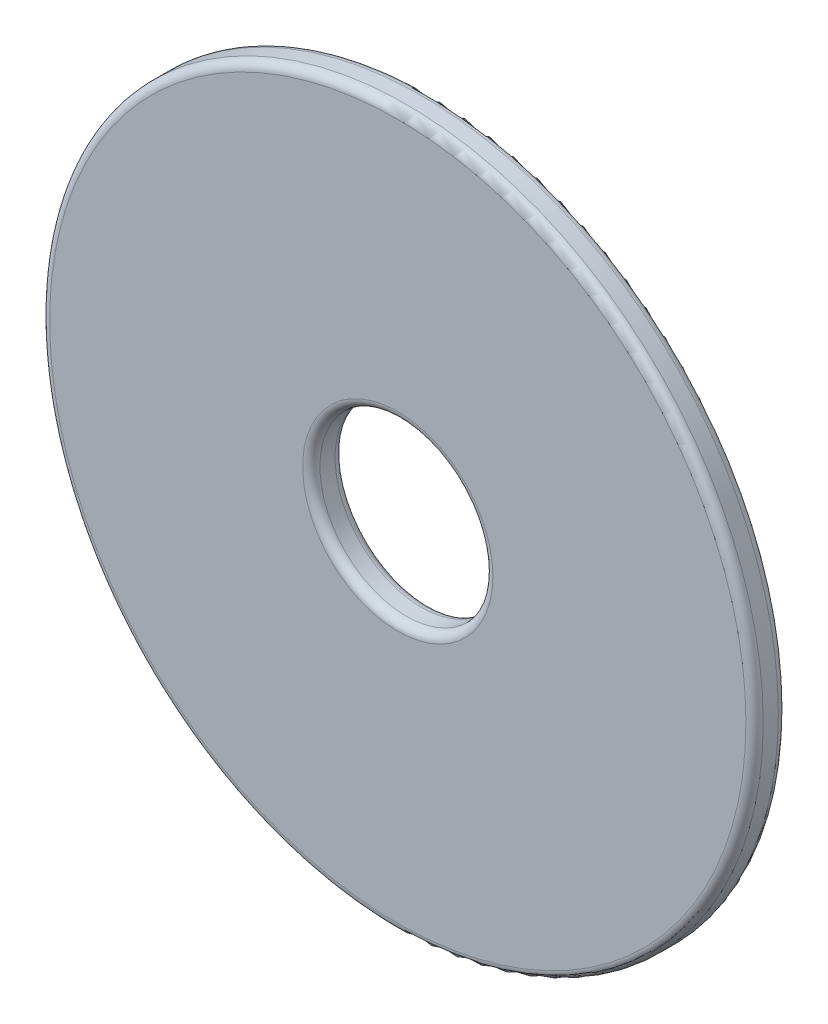
from build123d import *

# Parameters (mm, degrees)
ESQUISSE1_R      = 8.25
ESQUISSE1_R_2    = 2
EXTRUSION1_DEPTH = 0.75
CONG_1_R         = 0.2


with BuildPart() as part:
    # Esquisse1 → Extrusion1 (new body)
    with BuildSketch(Plane.XY):
        Circle(ESQUISSE1_R)
        Circle(ESQUISSE1_R_2, mode=Mode.SUBTRACT)
    extrude(amount=EXTRUSION1_DEPTH)

    # Congé1
    cong_1_edges = [part.edges().sort_by_distance(p)[0] for p in [
        (-8.25, 0, 0),
        (-8.25, 0, 0.75),
        (-2, 0, 0),
        (-2, 0, 0.75),
    ]]
    fillet(cong_1_edges, radius=CONG_1_R)


solid = part.part
